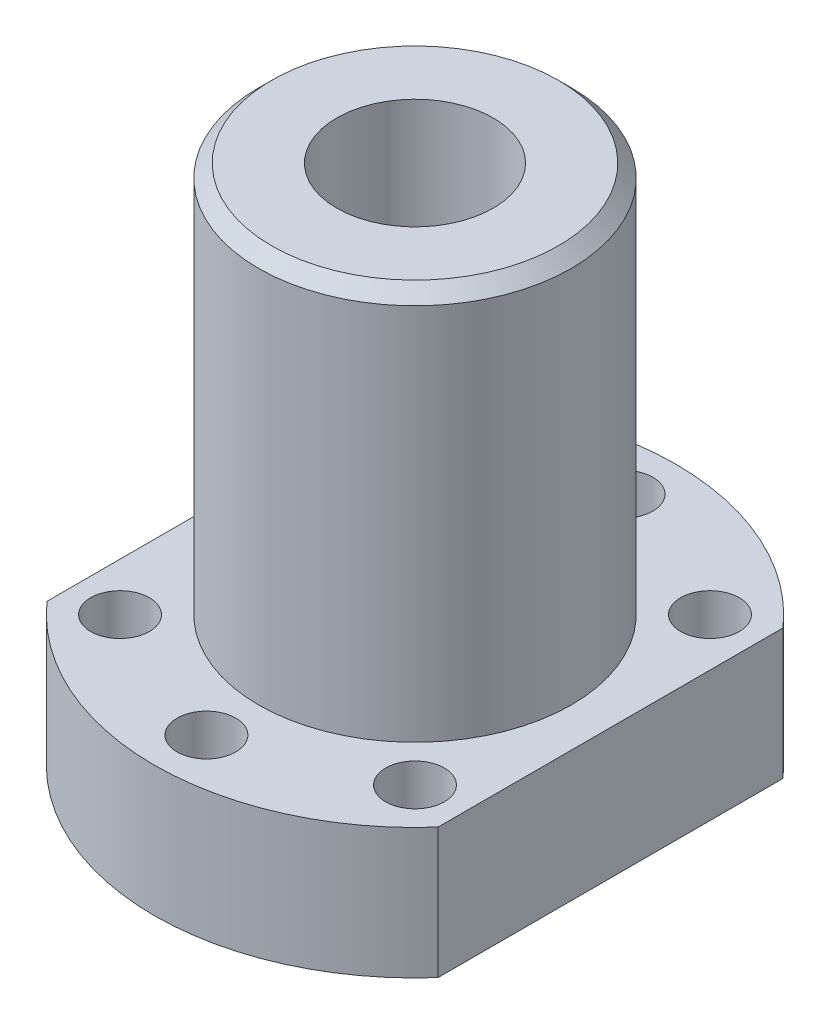
from build123d import *

# Parameters (mm, degrees)
SKETCH_1_R      = 6
SKETCH_1_R_2    = 2.25
EXTRUDE_1_DEPTH = 10
SKETCH_2_R      = 12
SKETCH_2_R_2    = 6
EXTRUDE_2_DEPTH = 30
CHAMFER_1_SIZE  = 1


with BuildPart() as part:
    # 草图1 → 凸台-拉伸1 (new body)
    with BuildSketch(Plane(origin=(0, 0, 0), x_dir=(1, 0, 0), z_dir=(0, 1, 0))):
        with BuildLine():
            Line((-15, 13.228756555), (-15, -13.228756555))
            ThreePointArc((-15, -13.228756555), (0, -20), (15, -13.228756555))
            Line((15, -13.228756555), (15, 13.228756555))
            ThreePointArc((15, 13.228756555), (0, 20), (-15, 13.228756555))
        make_face()
        with Locations(Location((0, 0, 0), (0, 0, 270))):
            Circle(SKETCH_1_R, mode=Mode.SUBTRACT)
        with Locations(Location((0, 16, 0), (0, 0, 270))):
            Circle(SKETCH_1_R_2, mode=Mode.SUBTRACT)
        with Locations(Location((11.313708499, 11.313708499, 0), (0, 0, 270))):
            Circle(SKETCH_1_R_2, mode=Mode.SUBTRACT)
        with Locations(Location((-11.313708499, 11.313708499, 0), (0, 0, 90))):
            Circle(SKETCH_1_R_2, mode=Mode.SUBTRACT)
        with Locations(Location((-11.313708499, -11.313708499, 0), (0, 0, 270))):
            Circle(SKETCH_1_R_2, mode=Mode.SUBTRACT)
        with Locations(Location((0, -16, 0), (0, 0, 90))):
            Circle(SKETCH_1_R_2, mode=Mode.SUBTRACT)
        with Locations(Location((11.313708499, -11.313708499, 0), (0, 0, 90))):
            Circle(SKETCH_1_R_2, mode=Mode.SUBTRACT)
    extrude(amount=EXTRUDE_1_DEPTH)

    # 草图2 → 凸台-拉伸2 (add)
    with BuildSketch(Plane(origin=(0, 10, 0), x_dir=(1, 0, 0), z_dir=(0, 1, 0))):
        with Locations(Location((0, 0, 0), (0, 0, 90))):
            Circle(SKETCH_2_R)
        with Locations(Location((0, 0, 0), (0, 0, 270))):
            Circle(SKETCH_2_R_2, mode=Mode.SUBTRACT)
    extrude(amount=EXTRUDE_2_DEPTH)

    # 倒角1
    chamfer_1_edges = [part.edges().sort_by_distance(p)[0] for p in [
        (0, 40, 12),
    ]]
    chamfer(chamfer_1_edges, length=CHAMFER_1_SIZE)


solid = part.part
